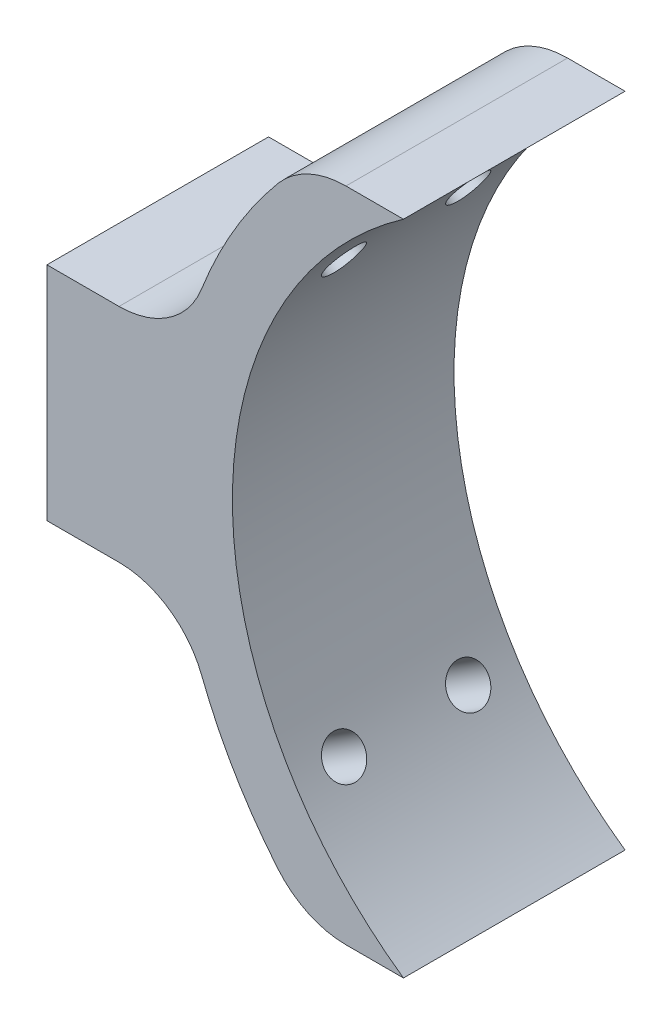
from build123d import *

# Parameters (mm, degrees)
BOSS_EXTRUDE1_DEPTH     = 12.5
SKETCH3_R               = 2.25
CUT_EXTRUDE1_DEPTH      = 77.872073504
CUT_EXTRUDE2_DEPTH      = 57.106034184
CUT_EXTRUDE2_DEPTH_BACK = 5
SKETCH5_R               = 2.25
FILLET4_R               = 10


with BuildPart() as part:
    # Sketch1 → Boss-Extrude1 (new, symmetric)
    with BuildSketch(Plane.XY):
        with BuildLine():
            Line((-66.175, -12.5), (-66.175, 12.5))
            Line((-66.175, 12.5), (-50.732755691, 12.5))
            ThreePointArc((-50.732755691, 12.5), (-45.469745991, 25.740332157), (-36.825635638, 37.066630004))
            Line((-36.825635638, 37.066630004), (-25.954333745, 37.066630004))
            ThreePointArc((-25.954333745, 37.066630004), (-45.25, 0), (-25.954333745, -37.066630004))
            Line((-25.954333745, -37.066630004), (-36.825635638, -37.066630004))
            ThreePointArc((-36.825635638, -37.066630004), (-45.469745991, -25.740332157), (-50.732755691, -12.5))
            Line((-50.732755691, -12.5), (-66.175, -12.5))
        make_face()
    extrude(amount=BOSS_EXTRUDE1_DEPTH, both=True)

    # Sketch3 → Cut-Extrude1 (cut, symmetric)
    with BuildSketch(Plane(origin=(0, 0, 0), x_dir=(0, 0, 1), z_dir=(-0.8433914458128852, 0.5372996083468248, 0))):
        with Locations(Location((-7, 0, 0), (0, 0, 90))):
            Circle(SKETCH3_R)
        with Locations(Location((7, 0, 0), (0, 0, 90))):
            Circle(SKETCH3_R)
    cut_extrude1 = extrude(amount=CUT_EXTRUDE1_DEPTH, both=True, mode=Mode.SUBTRACT)

    # Mirror1: Cut-Extrude1 across plane
    add(cut_extrude1.mirror(Plane.ZX), mode=Mode.SUBTRACT)

    # Sketch5 → Cut-Extrude2 (cut, two sides: drawn at the far end of the back side and taken through both)
    with BuildSketch(Plane.ZY.offset(66.175).offset(-CUT_EXTRUDE2_DEPTH_BACK)):
        with Locations(Location((-7, 7, 0), (0, 0, 180))):
            Circle(SKETCH5_R)
        with Locations(Location((7, 7, 0), (0, 0, 180))):
            Circle(SKETCH5_R)
        with Locations(Location((7, -7, 0), (0, 0, 180))):
            Circle(SKETCH5_R)
        with Locations(Location((-7, -7, 0), (0, 0, 180))):
            Circle(SKETCH5_R)
    extrude(amount=CUT_EXTRUDE2_DEPTH + CUT_EXTRUDE2_DEPTH_BACK, mode=Mode.SUBTRACT)

    # Fillet4
    fillet4_edges = [part.edges().sort_by_distance(p)[0] for p in [
        (-36.825635638, -37.066630004, 0),
        (-50.732755691, -12.5, 0),
        (-50.732755691, 12.5, 0),
        (-36.825635638, 37.066630004, 0),
    ]]
    fillet(fillet4_edges, radius=FILLET4_R)


solid = part.part
